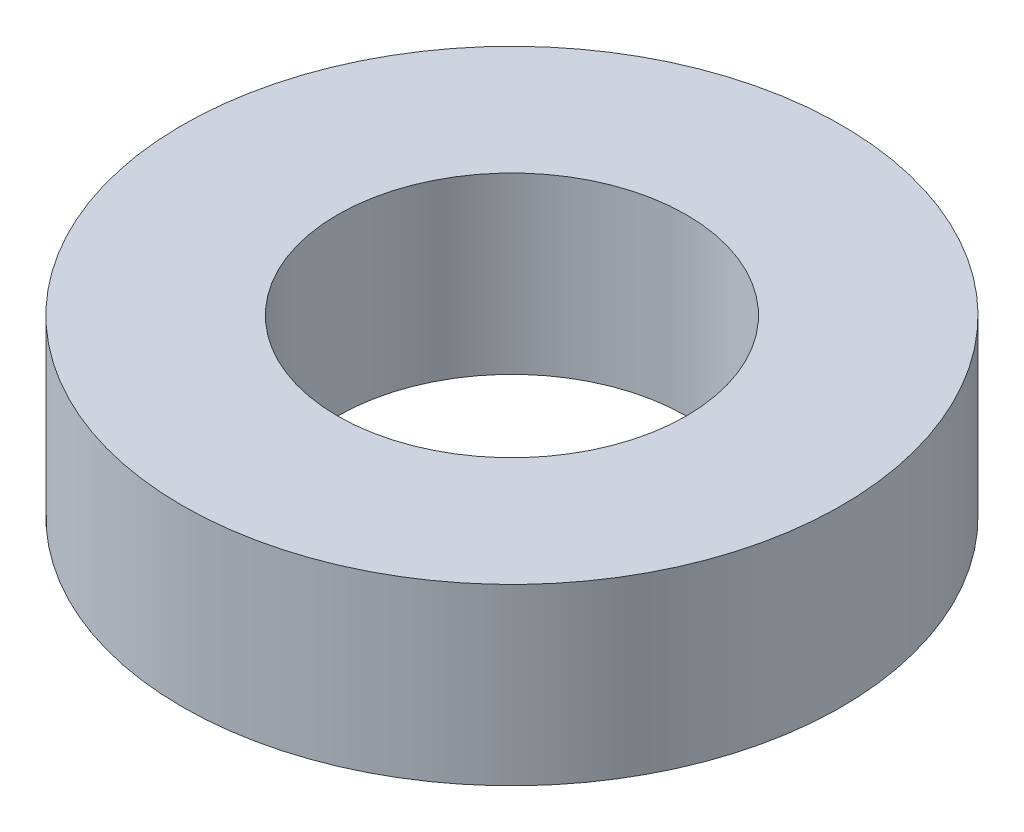
from build123d import *

# Parameters (mm, degrees)
ESQUISSE1_R             = 9.45
BOSS_EXTRU_1_DEPTH      = 5
ESQUISSE2_R             = 5
ENL_V_MAT_EXTRU_1_DEPTH = 7.7


with BuildPart() as part:
    # Esquisse1 → Boss.-Extru.1 (new body)
    with BuildSketch(Plane(origin=(0, 0, 0), x_dir=(1, 0, 0), z_dir=(0, 1, 0))):
        with Locations(Location((0, 0, 0), (0, 0, 270))):
            Circle(ESQUISSE1_R)
    extrude(amount=BOSS_EXTRU_1_DEPTH)

    # Esquisse2 → Enlèv. mat.-Extru.1 (cut)
    with BuildSketch(Plane.XZ):
        with Locations(Location((0, 0, 0), (0, 0, 270))):
            Circle(ESQUISSE2_R)
    extrude(amount=-ENL_V_MAT_EXTRU_1_DEPTH, mode=Mode.SUBTRACT)


solid = part.part
